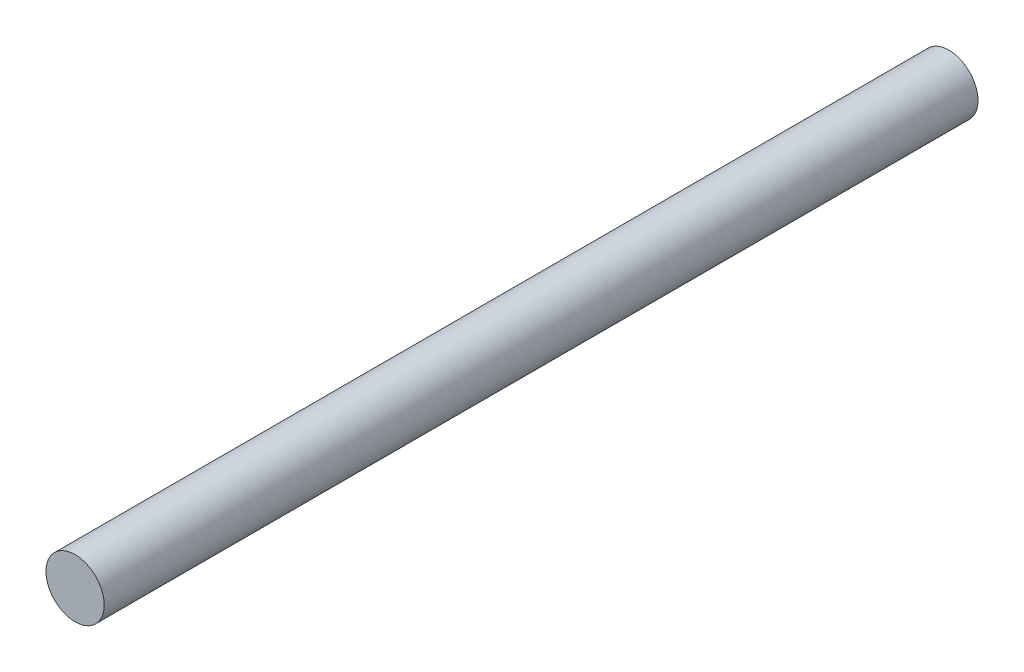
from build123d import *

# Parameters (mm, degrees)
SKETCH_1_R      = 2.5
EXTRUDE_2_DEPTH = 75


with BuildPart() as part:
    # ｽｹｯﾁ1 → ﾎﾞｽ - 押し出し2 (new body)
    with BuildSketch(Plane.XY):
        Circle(SKETCH_1_R)
    extrude(amount=EXTRUDE_2_DEPTH)


solid = part.part
